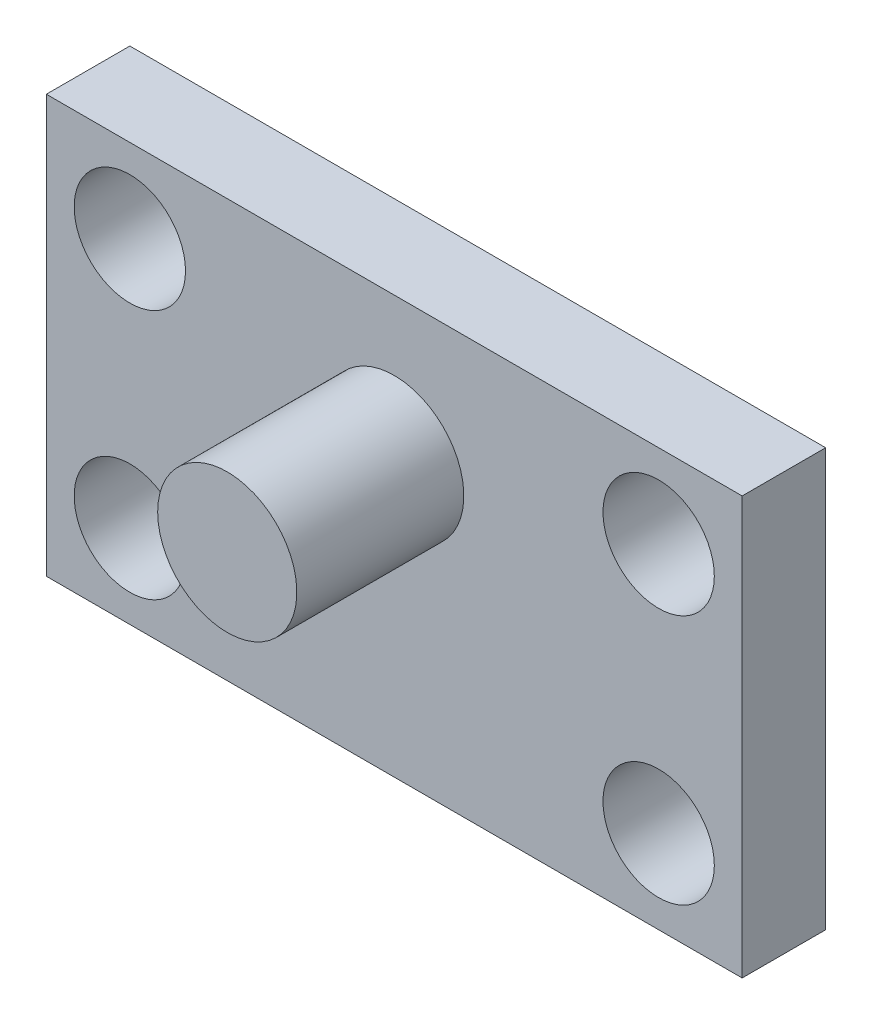
from build123d import *

# Parameters (mm, degrees)
SKETCH1_W           = 250
SKETCH1_H           = 150
SKETCH1_R           = 20
BOSS_EXTRUDE1_DEPTH = 30
SKETCH2_R           = 25
BOSS_EXTRUDE3_DEPTH = 90


with BuildPart() as part:
    # Sketch1 → Boss-Extrude1 (new body)
    with BuildSketch(Plane.XY):
        with Locations((125, 75)):
            Rectangle(SKETCH1_W, SKETCH1_H)
        with Locations((30, 30)):
            Circle(SKETCH1_R, mode=Mode.SUBTRACT)
        with Locations((220, 30)):
            Circle(SKETCH1_R, mode=Mode.SUBTRACT)
        with Locations((220, 120)):
            Circle(SKETCH1_R, mode=Mode.SUBTRACT)
        with Locations((30, 120)):
            Circle(SKETCH1_R, mode=Mode.SUBTRACT)
    extrude(amount=BOSS_EXTRUDE1_DEPTH)

    # Sketch2 → Boss-Extrude3 (add)
    with BuildSketch(Plane.XY):
        with Locations(Location((125, 100, 0), (0, 0, 180))):
            Circle(SKETCH2_R)
    extrude(amount=BOSS_EXTRUDE3_DEPTH)


solid = part.part
